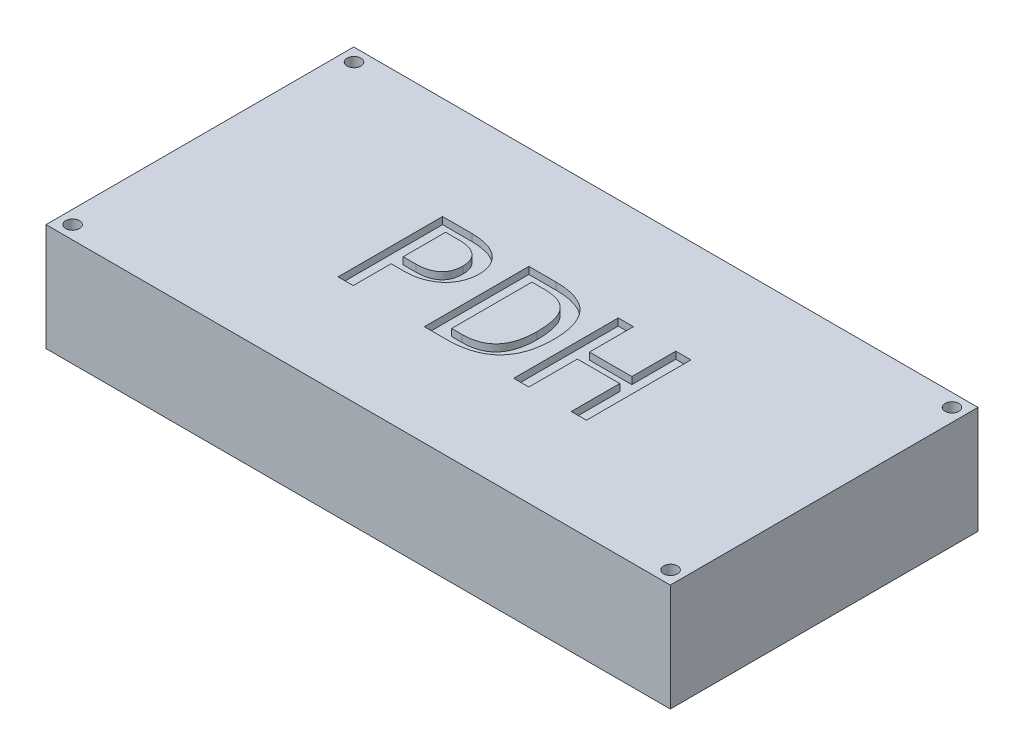
from build123d import *

# Parameters (mm, degrees)
SKETCH1_W           = 225.40000005
SKETCH1_H           = 111.10000005
SKETCH1_R           = 2.499999953
BOSS_EXTRUDE1_DEPTH = 19.38655
CUT_EXTRUDE1_DEPTH  = 2.54


with BuildPart() as part:
    # Sketch1 → Boss-Extrude1 (new, symmetric)
    with BuildSketch(Plane(origin=(0, 0, 0), x_dir=(1, 0, 0), z_dir=(0, 1, 0))):
        with Locations((112.700000025, 55.550000025)):
            Rectangle(SKETCH1_W, SKETCH1_H)
        with Locations(Location((4.800000052, 4.800000052, 0), (0, 0, 270))):
            Circle(SKETCH1_R, mode=Mode.SUBTRACT)
        with Locations(Location((4.800000052, 106.400000052, 0), (0, 0, 270))):
            Circle(SKETCH1_R, mode=Mode.SUBTRACT)
        with Locations(Location((220.700000052, 106.400000052, 0), (0, 0, 270))):
            Circle(SKETCH1_R, mode=Mode.SUBTRACT)
        with Locations(Location((220.700000052, 4.800000052, 0), (0, 0, 270))):
            Circle(SKETCH1_R, mode=Mode.SUBTRACT)
    extrude(amount=BOSS_EXTRUDE1_DEPTH, both=True)

    # Sketch2 → Cut-Extrude1 (cut)
    # profile 1 of 3: a face of its own
    with BuildSketch(Plane(origin=(0, 19.38655, 0), x_dir=(1, 0, 0), z_dir=(0, 1, 0))):
        with BuildLine():
            add(Edge.make_bspline(
                [(93.6654446, 62.638119725), (93.65621175, 62.255926888), (93.637663033, 61.488104777), (93.466421809, 60.341834085), (93.201255703, 59.201705874), (92.836997723, 58.075217304), (92.359286935, 56.979010165), (91.762331794, 55.932624231), (91.032595392, 54.955716054), (90.207106522, 54.027487516), (89.252652089, 53.179116743), (88.173798237, 52.414727304), (86.973600637, 51.734204765), (85.655660468, 51.128628725), (84.202701193, 50.653409294), (82.618753702, 50.300761726), (80.898189452, 50.099121533), (79.705954978, 50.07473573), (79.09029785, 50.062143162)],
                knots=[0, 0, 0, 0, 0.84837333, 1.704374698, 2.568122001, 3.446177459, 4.329841521, 5.219461111, 6.115085959, 7.03322926, 7.973947317, 8.94447037, 9.964314875, 11.034235969, 12.160282575, 13.352588404, 14.632904974, 16, 16, 16, 16], degree=3))
            Line((79.09029785, 50.062143162), (74.528088962, 50.062143162))
            Line((74.528088962, 50.062143162), (74.528088962, 36.39260342))
            Line((74.528088962, 36.39260342), (69.060273065, 36.39260342))
            Line((69.060273065, 36.39260342), (69.060273065, 74.120533108))
            Line((69.060273065, 74.120533108), (79.611449053, 74.120533108))
            add(Edge.make_bspline(
                [(79.611449053, 74.120533108), (80.070260309, 74.115673927), (80.980958213, 74.106028903), (82.329353652, 73.976911734), (83.651671763, 73.795021467), (84.937147693, 73.523102459), (86.171480276, 73.166358976), (87.344146306, 72.730911072), (88.422755699, 72.162952721), (89.43560104, 71.526521333), (90.368402205, 70.791840353), (91.189022047, 69.939252772), (91.912770344, 68.989458848), (92.539599198, 67.944691466), (93.055694596, 66.787250357), (93.402550005, 65.504823346), (93.635402669, 64.110350409), (93.655195832, 63.140369447), (93.6654446, 62.638119725)],
                knots=[0, 0, 0, 0, 1.071095419, 2.126025337, 3.160633674, 4.187194637, 5.191188192, 6.159546808, 7.102471747, 8.032359578, 8.950543616, 9.867691343, 10.788184798, 11.733733012, 12.707489344, 13.737062018, 14.82826569, 16, 16, 16, 16], degree=3))
        make_face()
        with BuildLine():
            add(Edge.make_bspline(
                [(88.197628703, 62.347642005), (88.192174404, 62.63850916), (88.18154377, 63.205420092), (88.067270065, 64.026417972), (87.887321266, 64.795998376), (87.642204989, 65.513494356), (87.324445545, 66.181041679), (86.9271256, 66.789508742), (86.462833318, 67.351595169), (85.92370252, 67.854044286), (85.320326107, 68.296325862), (84.670815804, 68.696121206), (83.954231053, 69.019190265), (83.180431142, 69.281086893), (82.353689397, 69.498799431), (81.465989989, 69.635809834), (80.527957319, 69.737538529), (79.882297045, 69.743319744), (79.551644817, 69.74628039)],
                knots=[0, 0, 0, 0, 1.07893025, 2.102875295, 3.069403633, 4.00867391, 4.911619206, 5.805799344, 6.69897942, 7.61127936, 8.532960211, 9.47193309, 10.436783978, 11.442898866, 12.50165651, 13.605056338, 14.773513735, 16, 16, 16, 16], degree=3))
            Line((79.551644817, 69.74628039), (74.528088962, 69.74628039))
            Line((74.528088962, 69.74628039), (74.528088962, 54.43639588))
            Line((74.528088962, 54.43639588), (79.115928237, 54.43639588))
            add(Edge.make_bspline(
                [(79.115928237, 54.43639588), (79.469215163, 54.444058583), (80.154049634, 54.458912469), (81.153694325, 54.542163566), (82.091850755, 54.691905292), (82.964265919, 54.917155421), (83.774695488, 55.18910777), (84.524586407, 55.521306188), (85.210072438, 55.925895812), (85.836535364, 56.387055958), (86.399655255, 56.909209561), (86.877940326, 57.506401351), (87.291847487, 58.157818385), (87.628287432, 58.875259995), (87.880108968, 59.657394144), (88.069138486, 60.497611643), (88.18153711, 61.401962584), (88.192147378, 62.025512532), (88.197628703, 62.347642005)],
                knots=[0, 0, 0, 0, 1.232805628, 2.389751021, 3.4973379, 4.54330244, 5.530003372, 6.477393866, 7.399377973, 8.301660217, 9.187431021, 10.070466494, 10.963674817, 11.874940633, 12.827061481, 13.825105319, 14.876436953, 16, 16, 16, 16], degree=3))
        make_face(mode=Mode.SUBTRACT)
    # profile 2 of 3: a face of its own
    with BuildSketch(Plane(origin=(0, 19.38655, 0), x_dir=(1, 0, 0), z_dir=(0, 1, 0))):
        with BuildLine():
            add(Edge.make_bspline(
                [(127.56590316, 55.675197919), (127.547617612, 54.78857119), (127.511689457, 53.046492477), (127.23969054, 50.905769989), (126.922569652, 49.262016243), (126.614411717, 48.087206761), (126.246431872, 46.950715858), (125.811824352, 45.860819894), (125.314265868, 44.812615172), (124.753130965, 43.8086857), (124.107420568, 42.863739226), (123.409082848, 41.959258432), (122.626828334, 41.117422828), (121.7596775, 40.338177311), (120.809466051, 39.618619159), (119.771337822, 38.967548349), (118.647283346, 38.391422091), (117.447711896, 37.861858683), (116.153140186, 37.424384305), (114.773384937, 37.046415803), (113.301688648, 36.744518404), (111.730514486, 36.548407326), (110.065508535, 36.414654635), (108.921503761, 36.400080642), (108.334569436, 36.39260342)],
                knots=[0, 0, 0, 0, 1.874627119, 3.68334034, 4.55511198, 5.414139205, 6.25033141, 7.080252411, 7.893905149, 8.703019486, 9.509911256, 10.312362027, 11.117881282, 11.936734267, 12.775179546, 13.635831221, 14.524848569, 15.444673208, 16.406604644, 17.411911457, 18.469143348, 19.580838344, 20.758843452, 22, 22, 22, 22], degree=3))
            Line((108.334569436, 36.39260342), (100.226823676, 36.39260342))
            Line((100.226823676, 36.39260342), (100.226823676, 74.120533108))
            Line((100.226823676, 74.120533108), (109.983457667, 74.120533108))
            add(Edge.make_bspline(
                [(109.983457667, 74.120533108), (110.698796565, 74.108775888), (112.087312401, 74.085954417), (114.099407103, 73.871359676), (115.971010991, 73.513186255), (117.705932553, 73.024742171), (119.296694788, 72.37897733), (120.753078111, 71.603929555), (122.063935524, 70.672214529), (123.234870408, 69.595919293), (124.268375898, 68.375042443), (125.15212849, 66.998343044), (125.905974417, 65.477332321), (126.520334079, 63.804439371), (126.984079723, 61.979297568), (127.323005556, 60.011417912), (127.529971236, 57.892365797), (127.553664927, 56.430354144), (127.56590316, 55.675197919)],
                knots=[0, 0, 0, 0, 1.17177347, 2.274482801, 3.310388109, 4.291013938, 5.222472681, 6.118087065, 6.988127256, 7.850034114, 8.717518086, 9.601485366, 10.523818561, 11.493740021, 12.515690363, 13.604990885, 14.762933224, 16, 16, 16, 16], degree=3))
        make_face()
        with BuildLine():
            add(Edge.make_bspline(
                [(122.098087263, 55.239481339), (122.091167759, 55.883338842), (122.07786261, 57.121378364), (121.941863816, 58.899207539), (121.714490077, 60.523833747), (121.395141619, 62.00003254), (120.973701982, 63.330931753), (120.478179626, 64.534888844), (119.856705316, 65.588603714), (119.150728012, 66.521049001), (118.340699821, 67.317635038), (117.439068976, 68.005524695), (116.438452675, 68.568612468), (115.337592989, 69.003716428), (114.147410598, 69.331977904), (112.863376849, 69.585308184), (111.475458259, 69.713259964), (110.519060263, 69.735050507), (110.026174979, 69.74628039)],
                knots=[0, 0, 0, 0, 1.413547595, 2.71803587, 3.911871408, 5.013341294, 6.029850817, 6.974090411, 7.865305992, 8.708270035, 9.535123508, 10.351794371, 11.191784495, 12.047569406, 12.944296091, 13.8996306, 14.91756238, 16, 16, 16, 16], degree=3))
            Line((110.026174979, 69.74628039), (105.694639573, 69.74628039))
            Line((105.694639573, 69.74628039), (105.694639573, 40.766856138))
            Line((105.694639573, 40.766856138), (109.462306464, 40.766856138))
            add(Edge.make_bspline(
                [(109.462306464, 40.766856138), (109.972390662, 40.779628967), (110.963897054, 40.804456912), (112.404673192, 40.959074575), (113.741396992, 41.254449715), (114.982492322, 41.645412228), (116.128283102, 42.146846942), (117.168651881, 42.778873861), (118.119824521, 43.514260641), (118.95603885, 44.379608434), (119.710984868, 45.341779056), (120.348177326, 46.429272224), (120.897700383, 47.621563924), (121.340339899, 48.927882581), (121.678563879, 50.347150333), (121.924720399, 51.877582623), (122.068484344, 53.522343822), (122.088017719, 54.655390557), (122.098087263, 55.239481339)],
                knots=[0, 0, 0, 0, 1.112402768, 2.162298815, 3.153767855, 4.092494856, 4.996014567, 5.873553179, 6.740614794, 7.610074679, 8.4907496, 9.401305331, 10.351566166, 11.349161427, 12.403455731, 13.529502205, 14.72644707, 16, 16, 16, 16], degree=3))
        make_face(mode=Mode.SUBTRACT)
    # profile 3 of 3: a face of its own
    with BuildSketch(Plane(origin=(0, 19.38655, 0), x_dir=(1, 0, 0), z_dir=(0, 1, 0))):
        Polygon((158.732453771, 36.39260342), (153.264637875, 36.39260342), (153.264637875, 53.88961429), (137.954753364, 53.88961429), (137.954753364, 36.39260342), (132.486937467, 36.39260342), (132.486937467, 74.120533108), (137.954753364, 74.120533108), (137.954753364, 58.263867007), (153.264637875, 58.263867007), (153.264637875, 74.120533108), (158.732453771, 74.120533108), align=None)
    extrude(amount=-CUT_EXTRUDE1_DEPTH, mode=Mode.SUBTRACT)


solid = part.part
